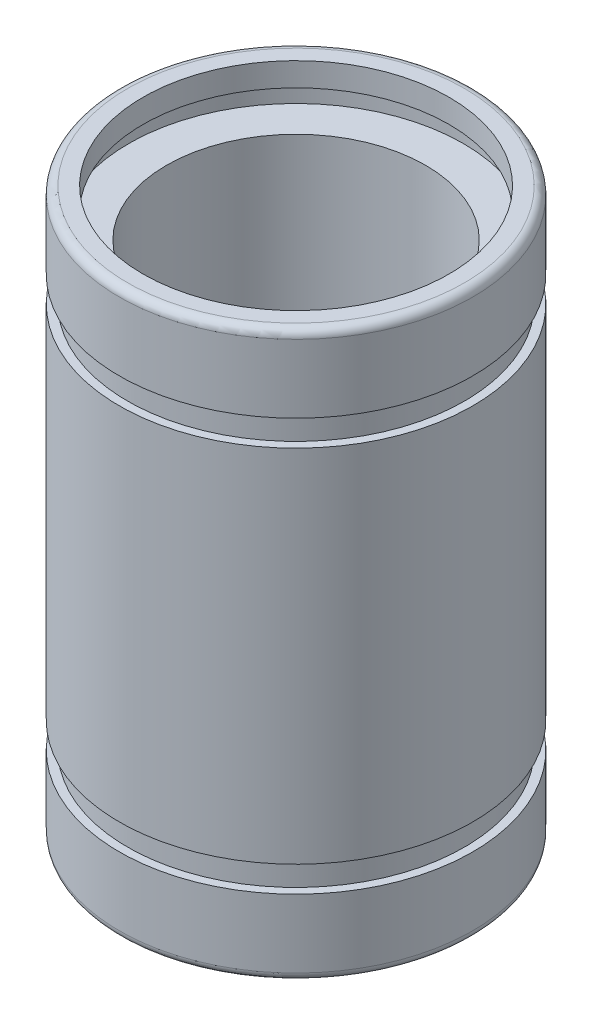
from build123d import *


with BuildPart() as part:
    # Sketch1 → Revolve1 (revolve)
    with BuildSketch(Plane(origin=(0, 0, 0), x_dir=(0, -1, 0), z_dir=(1, 0, 0))):
        with BuildLine():
            Line((-8.75, 7.5), (-11.65, 7.5))
            ThreePointArc((-11.65, 7.5), (-11.897487373, 7.397487373), (-12, 7.15))
            Line((-12, 7.15), (-12, 6.5))
            Line((-12, 6.5), (-11, 6.5))
            Line((-11, 6.5), (-11, 7.1))
            Line((-11, 7.1), (-10, 7.1))
            Line((-10, 7.1), (-10, 5.5))
            Line((-10, 5.5), (10, 5.5))
            Line((10, 5.5), (10, 7.1))
            Line((10, 7.1), (11, 7.1))
            Line((11, 7.1), (11, 6.5))
            Line((11, 6.5), (12, 6.5))
            Line((12, 6.5), (12, 7.15))
            ThreePointArc((12, 7.15), (11.897487373, 7.397487373), (11.65, 7.5))
            Line((11.65, 7.5), (8.75, 7.5))
            Line((8.75, 7.5), (8.75, 7.15))
            Line((8.75, 7.15), (7.65, 7.15))
            Line((7.65, 7.15), (7.65, 7.5))
            Line((7.65, 7.5), (-7.65, 7.5))
            Line((-7.65, 7.5), (-7.65, 7.15))
            Line((-7.65, 7.15), (-8.75, 7.15))
            Line((-8.75, 7.15), (-8.75, 7.5))
        make_face()
    revolve(axis=Axis((0, 12, 0), (0, -1, 0)))


solid = part.part
